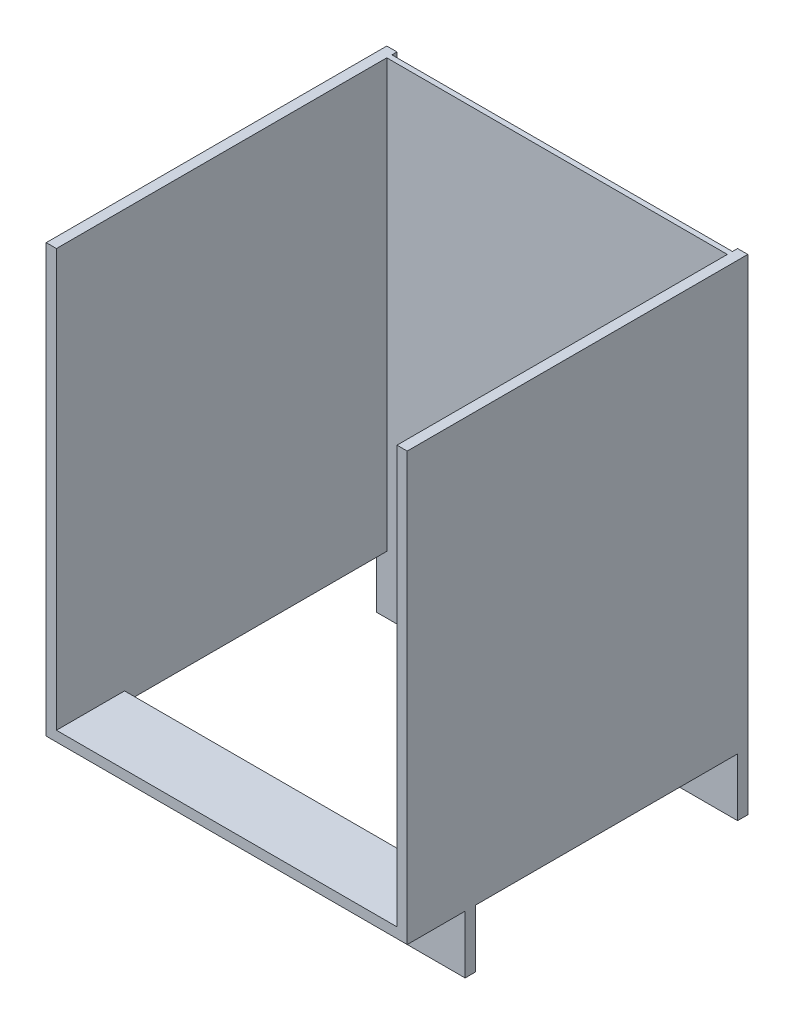
from build123d import *

# Parameters (mm, degrees)
SKETCH2_W           = 636
SKETCH2_H           = 753
BOSS_EXTRUDE1_DEPTH = 600
SKETCH3_W           = 600
SKETCH3_H           = 735
CUT_EXTRUDE1_DEPTH  = 600
BOSS_EXTRUDE2_START = -18
SKETCH4_W           = 600
SKETCH4_H           = 735
BOSS_EXTRUDE2_DEPTH = 9
BOSS_EXTRUDE3_START = -102
SKETCH5_W           = 636
SKETCH5_H           = 102
BOSS_EXTRUDE3_DEPTH = 18
SKETCH6_W           = 636
SKETCH6_H           = 102
BOSS_EXTRUDE4_DEPTH = 18
CUT_EXTRUDE2_REACH  = 1155.909
SKETCH7_W           = 600
SKETCH7_H           = 462


with BuildPart() as part:
    # Sketch2 → Boss-Extrude1 (new body)
    with BuildSketch(Plane.XY):
        with Locations((318, 376.5)):
            Rectangle(SKETCH2_W, SKETCH2_H)
    extrude(amount=BOSS_EXTRUDE1_DEPTH)

    # Sketch3 → Cut-Extrude1 (cut)
    with BuildSketch(Plane.XY.offset(600)):
        with Locations((318, 385.5)):
            Rectangle(SKETCH3_W, SKETCH3_H)
    extrude(amount=-CUT_EXTRUDE1_DEPTH, mode=Mode.SUBTRACT)

    # Sketch4 → Boss-Extrude2 (add)
    with BuildSketch(Plane(origin=(0, 0, 0), x_dir=(-1, 0, 0), z_dir=(0, 0, -1)).offset(BOSS_EXTRUDE2_START)):
        with Locations((-318, 385.5)):
            Rectangle(SKETCH4_W, SKETCH4_H)
    extrude(amount=BOSS_EXTRUDE2_DEPTH)

    # Sketch5 → Boss-Extrude3 (add)
    with BuildSketch(Plane.XY.offset(600).offset(BOSS_EXTRUDE3_START)):
        with Locations((318, -51)):
            Rectangle(SKETCH5_W, SKETCH5_H)
    extrude(amount=-BOSS_EXTRUDE3_DEPTH)

    # Sketch6 → Boss-Extrude4 (add)
    with BuildSketch(Plane(origin=(0, 0, 0), x_dir=(-1, 0, 0), z_dir=(0, 0, -1))):
        with Locations((-318, -51)):
            Rectangle(SKETCH6_W, SKETCH6_H)
    extrude(amount=-BOSS_EXTRUDE4_DEPTH)

    # Sketch7 → Cut-Extrude2 (cut, up to next)
    with BuildSketch(Plane.XZ, mode=Mode.PRIVATE) as cut_extrude2_sk1:
        with Locations((318, 249)):
            Rectangle(SKETCH7_W, SKETCH7_H)
    cut_extrude2_tool1 = extrude(cut_extrude2_sk1.sketch, amount=-CUT_EXTRUDE2_REACH, mode=Mode.PRIVATE) & part.part
    add(cut_extrude2_tool1.solids().sort_by_distance((318, 0, 249))[0], mode=Mode.SUBTRACT)


solid = part.part
